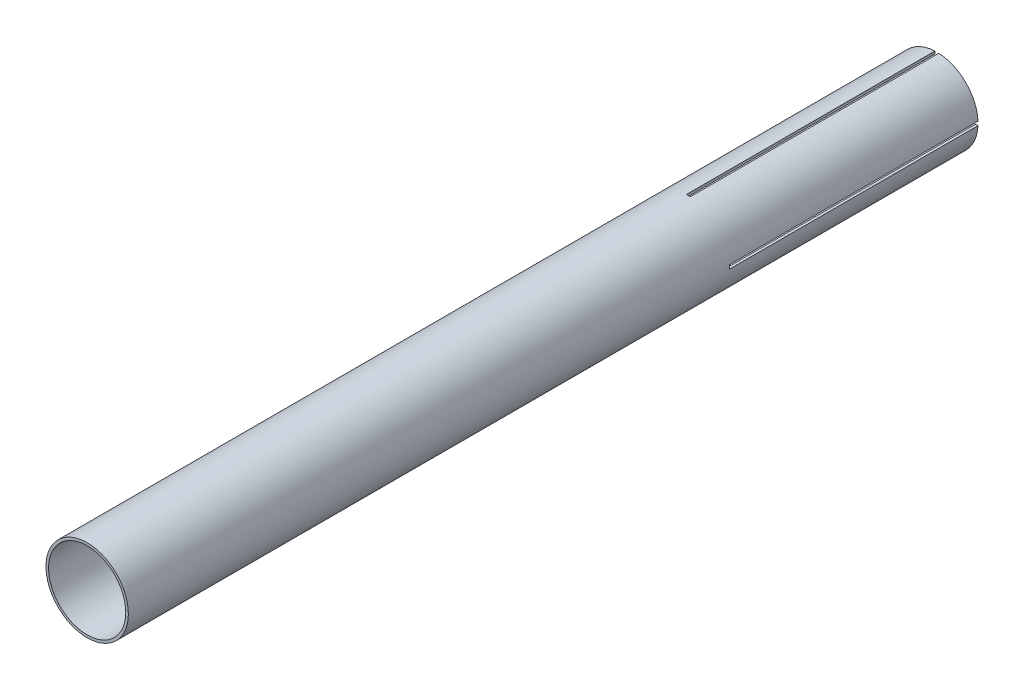
from build123d import *

# Parameters (mm, degrees)
SKETCH1_R           = 32
SKETCH1_R_2         = 30
BOSS_EXTRUDE1_DEPTH = 660
CUT_EXTRUDE1_REACH  = 663.55
SKETCH2_W           = 3
SKETCH2_H           = 193
CIRPATTERN1_COUNT   = 4


with BuildPart() as part:
    # Sketch1 → Boss-Extrude1 (new body)
    with BuildSketch(Plane.XY):
        Circle(SKETCH1_R)
        Circle(SKETCH1_R_2, mode=Mode.SUBTRACT)
    extrude(amount=BOSS_EXTRUDE1_DEPTH)

    # Sketch2 → Cut-Extrude1 (cut, up to next)
    with BuildSketch(Plane(origin=(0, 0, 0), x_dir=(1, 0, 0), z_dir=(0, 1, 0)), mode=Mode.PRIVATE) as cut_extrude1_sk1:
        with Locations((0, -96.5)):
            Rectangle(SKETCH2_W, SKETCH2_H)
    cut_extrude1_tool1 = extrude(cut_extrude1_sk1.sketch, amount=-CUT_EXTRUDE1_REACH, mode=Mode.PRIVATE) & part.part
    cut_extrude1 = cut_extrude1_tool1.solids().sort_by_distance((0, 0, 96.5))[0]
    add(cut_extrude1, mode=Mode.SUBTRACT)

    # CirPattern1: Cut-Extrude1 ×4 about axis
    cirpattern1_axis = Axis((0, 0, 660), (0, 0, -1))
    for i in range(1, CIRPATTERN1_COUNT):
        add(cut_extrude1.rotate(cirpattern1_axis, i * 360 / CIRPATTERN1_COUNT), mode=Mode.SUBTRACT)


solid = part.part
